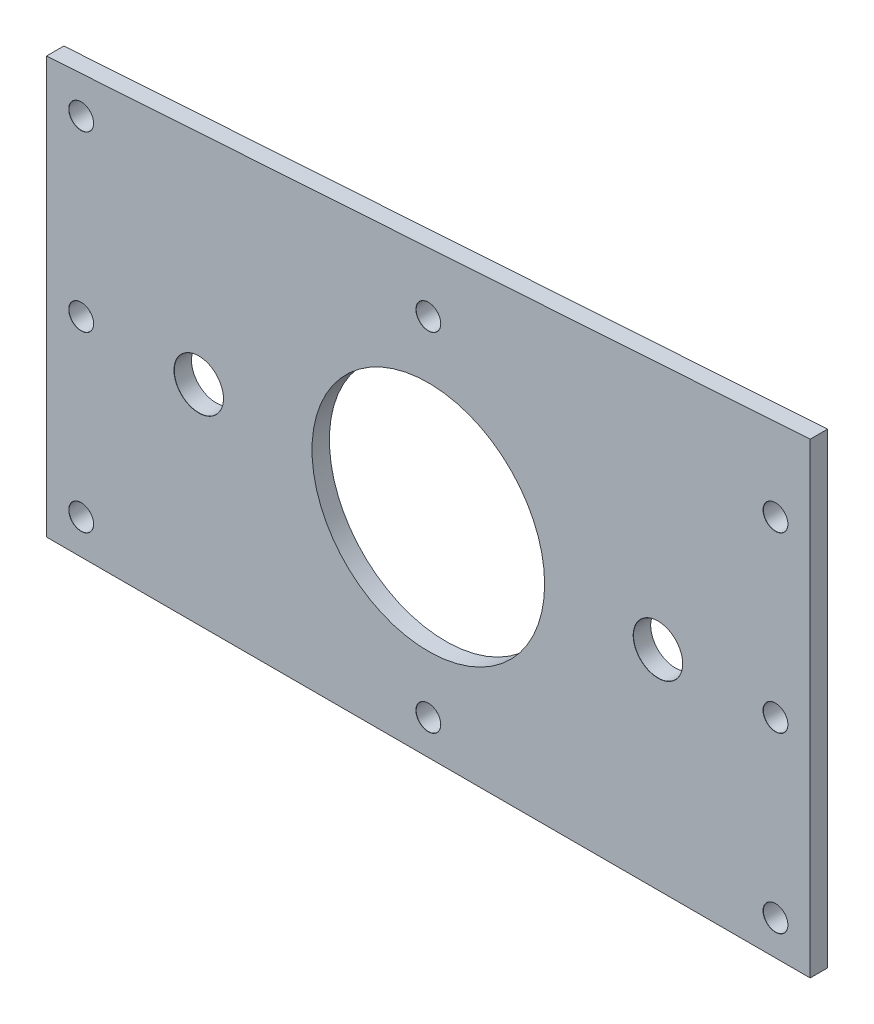
from build123d import *

# Parameters (mm, degrees)
BOSS_EXTRUDE1_DEPTH            = 3.175
M4_CLEARANCE_HOLE1_D           = 4.5
M4_CLEARANCE_HOLE1_CSINK_D     = 4.55
M4_CLEARANCE_HOLE1_CSINK_ANGLE = 90
M8_CLEARANCE_HOLE1_AT_2_COUNT  = 2
M8_CLEARANCE_HOLE1_AT_2_PITCH  = 84
SKETCH9_R                      = 21.275
CENTER_HOLE_DEPTH              = 85.39355735


with BuildPart() as part:
    # Sketch1 → Boss-Extrude1 (new body)
    with BuildSketch(Plane.XY):
        Polygon((-69.85, 38.1), (69.85, 47.256421755), (69.85, 38.1), (69.85, -38.1), (-69.85, -38.1), align=None)
    extrude(amount=BOSS_EXTRUDE1_DEPTH)

    # M4 Clearance Hole1 (through all)
    with Locations(Plane.XY.offset(3.175)):
        with Locations((-63.5, -31.75), (0, -31.75), (63.5, -31.75), (63.5, 31.75), (63.5, 0), (0, 31.75), (-63.5, 31.75), (-63.5, 0)):
            CounterSinkHole(M4_CLEARANCE_HOLE1_D / 2, M4_CLEARANCE_HOLE1_CSINK_D / 2, counter_sink_angle=M4_CLEARANCE_HOLE1_CSINK_ANGLE)

    # Sketch11 → M8 Clearance Hole1 (revolve, cut)
    with BuildSketch(Plane(origin=(-42, 0, 3.175), x_dir=(0, -1, 0), z_dir=(1, 0, 0))):
        Polygon((0, 0), (0, 3.175), (4.5, 3.175), (4.5, 0.025), (4.525, 0), align=None)
    m8_clearance_hole1 = revolve(axis=Axis((-42, 0, 9.525), (0, 0, -1)), mode=Mode.SUBTRACT)

    # M8 Clearance Hole1 at 2: M8 Clearance Hole1 ×2
    with Locations(*[(i * M8_CLEARANCE_HOLE1_AT_2_PITCH, 0, 0) for i in range(1, M8_CLEARANCE_HOLE1_AT_2_COUNT)]):
        add(m8_clearance_hole1, mode=Mode.SUBTRACT)

    # Sketch9 → Center Hole (cut, through all)
    with BuildSketch(Plane.XY.offset(3.175)):
        Circle(SKETCH9_R)
    extrude(amount=-CENTER_HOLE_DEPTH, mode=Mode.SUBTRACT)


solid = part.part
